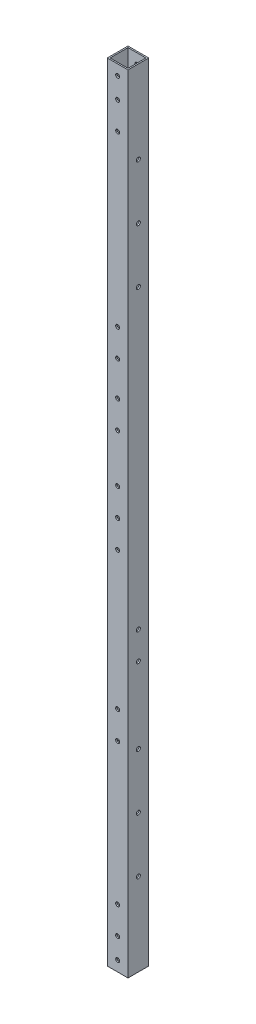
from build123d import *

# Parameters (mm, degrees)
SKETCH_1_W               = 15
SKETCH_1_H               = 15
SKETCH_1_W_2             = 13
SKETCH_1_H_2             = 13
EXTRUDE_1_DEPTH          = 570
CUT_EXTRUDE_1_DEPTH      = 10
CUT_EXTRUDE_1_DEPTH_BACK = 571.098675669
SKETCH_2_R               = 1.45
SKETCH_3_R               = 1.45
CUT_EXTRUDE_2_DEPTH      = 571.246657158


with BuildPart() as part:
    # 草图1 → 拉伸-薄壁1 (new body)
    with BuildSketch(Plane(origin=(0, 0, 0), x_dir=(1, 0, 0), z_dir=(0, 1, 0))):
        Rectangle(SKETCH_1_W, SKETCH_1_H)
        Rectangle(SKETCH_1_W_2, SKETCH_1_H_2, mode=Mode.SUBTRACT)
    extrude(amount=EXTRUDE_1_DEPTH)

    # 草图2 → 切除-拉伸1 (cut, two sides: drawn at the far end of the back side and taken through both)
    with BuildSketch(Plane.XY.offset(-CUT_EXTRUDE_1_DEPTH_BACK)):
        with Locations(Location((0, 7.5, 0), (0, 0, 180))):
            Circle(SKETCH_2_R)
        with Locations(Location((0, 22.5, 0), (0, 0, 180))):
            Circle(SKETCH_2_R)
        with Locations(Location((0, 42.5, 0), (0, 0, 180))):
            Circle(SKETCH_2_R)
        with Locations(Location((0, 527.5, 0), (0, 0, 180))):
            Circle(SKETCH_2_R)
        with Locations(Location((0, 547.5, 0), (0, 0, 180))):
            Circle(SKETCH_2_R)
        with Locations(Location((0, 562.5, 0), (0, 0, 180))):
            Circle(SKETCH_2_R)
        with Locations(Location((0, 285, 0), (0, 0, 180))):
            Circle(SKETCH_2_R)
        with Locations(Location((0, 305, 0), (0, 0, 180))):
            Circle(SKETCH_2_R)
        with Locations(Location((0, 265, 0), (0, 0, 180))):
            Circle(SKETCH_2_R)
        with Locations(Location((0, 405, 0), (0, 0, 180))):
            Circle(SKETCH_2_R)
        with Locations(Location((0, 385, 0), (0, 0, 180))):
            Circle(SKETCH_2_R)
        with Locations(Location((0, 165, 0), (0, 0, 180))):
            Circle(SKETCH_2_R)
        with Locations(Location((0, 145, 0), (0, 0, 180))):
            Circle(SKETCH_2_R)
        with Locations(Location((0, 340, 0), (0, 0, 180))):
            Circle(SKETCH_2_R)
        with Locations(Location((0, 360, 0), (0, 0, 180))):
            Circle(SKETCH_2_R)
    extrude(amount=CUT_EXTRUDE_1_DEPTH + CUT_EXTRUDE_1_DEPTH_BACK, mode=Mode.SUBTRACT)

    # 草图3 → 切除-拉伸2 (cut, through all)
    with BuildSketch(Plane(origin=(7.5, 0, 0), x_dir=(0, 0, -1), z_dir=(1, 0, 0))):
        with Locations((0, 60)):
            Circle(SKETCH_3_R)
        with Locations((0, 100)):
            Circle(SKETCH_3_R)
        with Locations((0, 470)):
            Circle(SKETCH_3_R)
        with Locations((0, 510)):
            Circle(SKETCH_3_R)
        with Locations((0, 140)):
            Circle(SKETCH_3_R)
        with Locations((0, 430)):
            Circle(SKETCH_3_R)
        with Locations((0, 195)):
            Circle(SKETCH_3_R)
        with Locations((0, 215)):
            Circle(SKETCH_3_R)
    extrude(amount=-CUT_EXTRUDE_2_DEPTH, mode=Mode.SUBTRACT)


solid = part.part
